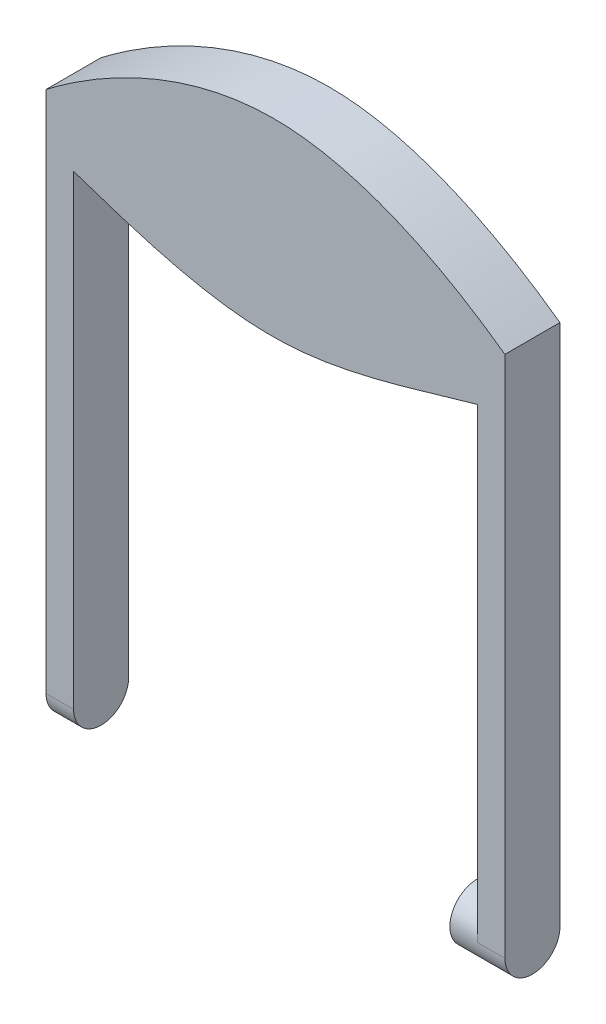
from build123d import *

# Parameters (mm, degrees)
EXTRUDE_1_DEPTH          = 6
CUT_EXTRUDE_1_DEPTH      = 86.959139
CUT_EXTRUDE_1_DEPTH_BACK = 86.959139
SKETCH_3_R               = 2.05
EXTRUDE_2_DEPTH          = 3


with BuildPart() as part:
    # 草图1 → 凸台-拉伸1 (new body)
    with BuildSketch(Plane.XY):
        with BuildLine():
            Line((0, 0), (0, 60))
            add(Edge.make_bspline(
                [(0, 60), (6.932027, 65.303268), (25.02154, 74.137336), (42.974448, 65.073065), (50, 60)],
                knots=[0, 0, 0, 0, 0.50035, 1, 1, 1, 1], degree=3))
            Line((50, 60), (50, 0))
            Line((50, 0), (47, 0))
            Line((47, 0), (47, 53.774366))
            add(Edge.make_bspline(
                [(3, 53.774366), (9.965867, 51.405734), (25.033485, 46.45053), (39.925766, 51.813875), (47, 53.774366)],
                knots=[0, 0, 0, 0, 0.500345, 1, 1, 1, 1], degree=3))
            Line((3, 53.774366), (3, 0))
            Line((3, 0), (0, 0))
        make_face()
    extrude(amount=EXTRUDE_1_DEPTH)

    # 草图2 → 切除-拉伸1 (cut, two sides: drawn at the far end of the back side and taken through both)
    with BuildSketch(Plane.ZY.offset(-CUT_EXTRUDE_1_DEPTH_BACK)):
        with BuildLine():
            Line((0, 0), (3, 0))
            ThreePointArc((3, 0), (0.87868, 0.87868), (0, 3))
            Line((0, 3), (0, 0))
        make_face()
        with BuildLine():
            Line((6, 0), (6, 3))
            ThreePointArc((6, 3), (5.12132, 0.87868), (3, 0))
            Line((3, 0), (6, 0))
        make_face()
    extrude(amount=CUT_EXTRUDE_1_DEPTH + CUT_EXTRUDE_1_DEPTH_BACK, mode=Mode.SUBTRACT)

    # 草图3 → 凸台-拉伸2 (add)
    with BuildSketch(Plane.ZY.offset(-47)):
        with BuildLine():
            ThreePointArc((6, 3), (3, 6), (0, 3))
            ThreePointArc((0, 3), (3, 0), (6, 3))
        make_face()
        with Locations(Location((3, 3, 0), (0, 0, 270))):
            Circle(SKETCH_3_R, mode=Mode.SUBTRACT)
    extrude(amount=EXTRUDE_2_DEPTH)


solid = part.part
